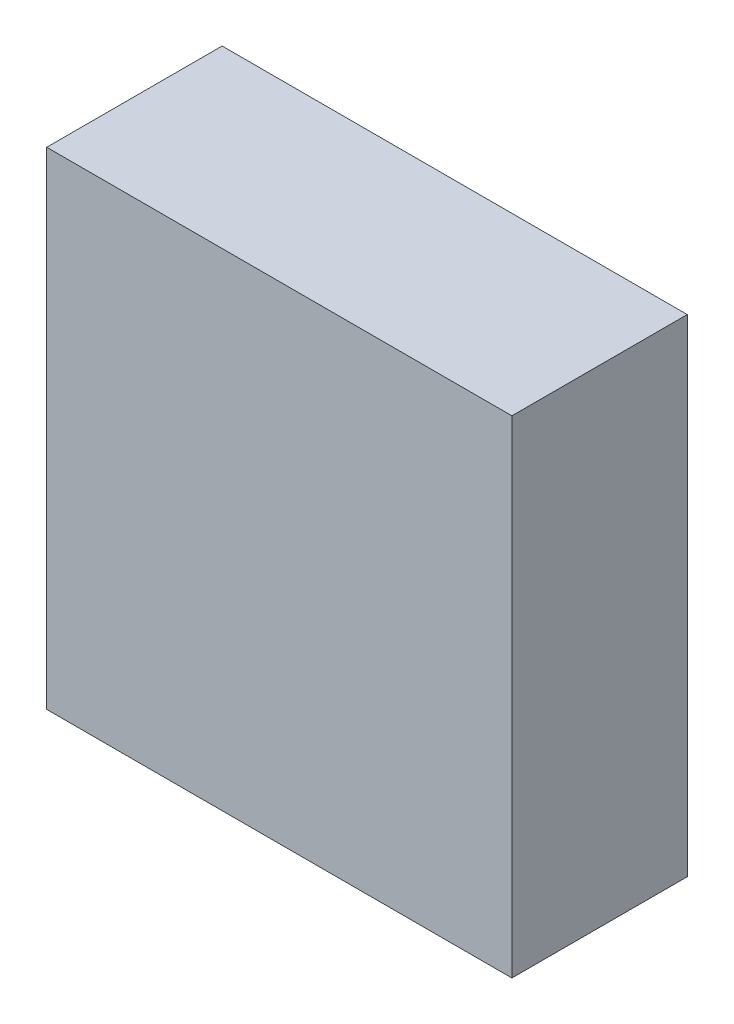
from build123d import *

# Parameters (mm, degrees)
SKETCH1_W               = 2.6524
SKETCH1_H               = 2.7762
COMPONENT_OUTLINE_DEPTH = 1


with BuildPart() as part:
    # Sketch1 → Component_Outline (new body)
    with BuildSketch(Plane.XY):
        with Locations((0, 0.0381)):
            Rectangle(SKETCH1_W, SKETCH1_H)
    extrude(amount=COMPONENT_OUTLINE_DEPTH)


solid = part.part
